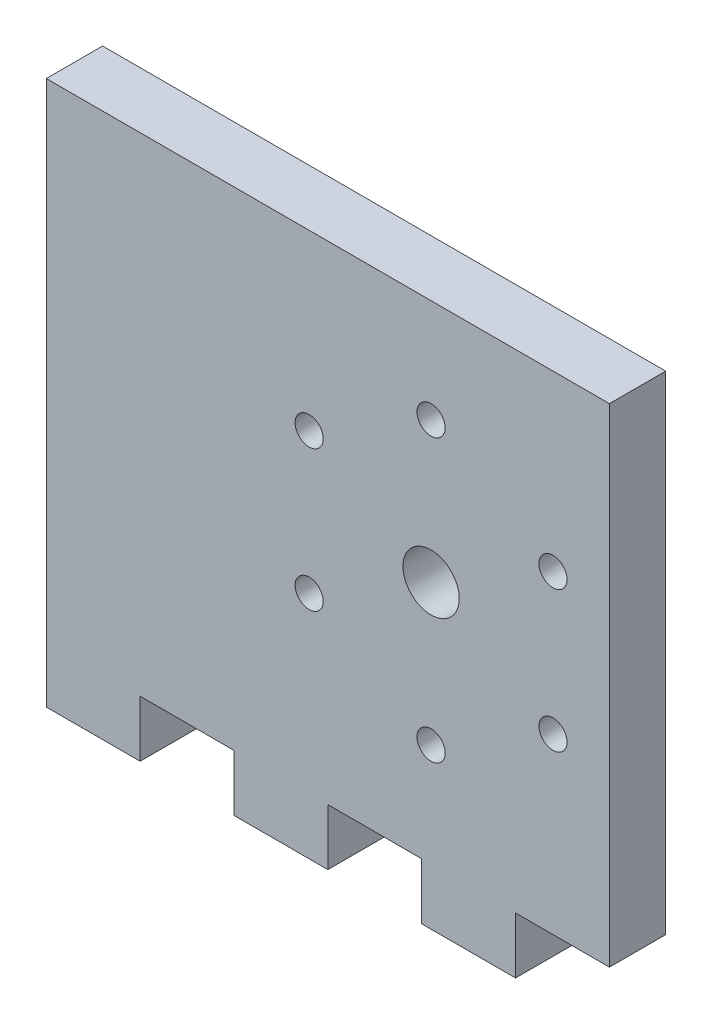
from build123d import *

# Parameters (mm, degrees)
SKETCH1_R             = 0.75
SKETCH1_R_2           = 1.5
BOSS_EXTRUDE1_DEPTH   = 3
CORTAR_EXTRUIR1_START = -3
CROQUIS1_W            = 15
CROQUIS1_H            = 6.71890751
CORTAR_EXTRUIR1_DEPTH = 3


with BuildPart() as part:
    # Sketch1 → Boss-Extrude1 (new body)
    with BuildSketch(Plane.XY):
        Polygon((10, 0), (10, 3), (15, 3), (15, 0), (20, 0), (20, 3), (25, 3), (25, 0), (30, 0), (30, -26), (25, -26), (25, -29), (20, -29), (20, -26), (15, -26), (15, -29), (10, -29), (10, -26), (5, -26), (5, -29), (0, -29), (0, 0), align=None)
        with Locations((20.5, -5.5)):
            Circle(SKETCH1_R, mode=Mode.SUBTRACT)
        with Locations((26.995190528, -9.25)):
            Circle(SKETCH1_R, mode=Mode.SUBTRACT)
        with Locations((26.995190528, -16.75)):
            Circle(SKETCH1_R, mode=Mode.SUBTRACT)
        with Locations((20.5, -20.5)):
            Circle(SKETCH1_R, mode=Mode.SUBTRACT)
        with Locations((14.004809472, -16.75)):
            Circle(SKETCH1_R, mode=Mode.SUBTRACT)
        with Locations((14.004809472, -9.25)):
            Circle(SKETCH1_R, mode=Mode.SUBTRACT)
        with Locations((20.5, -13)):
            Circle(SKETCH1_R_2, mode=Mode.SUBTRACT)
    extrude(amount=BOSS_EXTRUDE1_DEPTH)

    # Croquis1 → Cortar-Extruir1 (cut)
    with BuildSketch(Plane.XY.offset(3).offset(CORTAR_EXTRUIR1_START)):
        with Locations((17.5, 3.359453755)):
            Rectangle(CROQUIS1_W, CROQUIS1_H)
    extrude(amount=CORTAR_EXTRUIR1_DEPTH, mode=Mode.SUBTRACT)


solid = part.part
